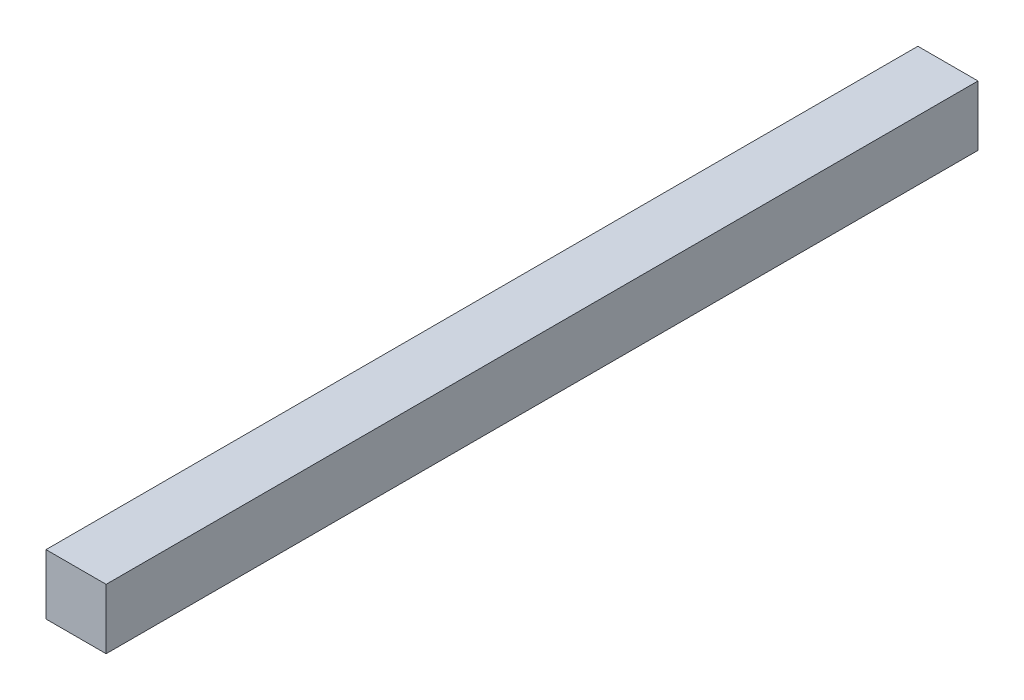
from build123d import *

# Parameters (mm, degrees)
SKETCH1_W           = 38.1
SKETCH1_H           = 38.1
BOSS_EXTRUDE1_DEPTH = 552.45


with BuildPart() as part:
    # Sketch1 → Boss-Extrude1 (new body)
    with BuildSketch(Plane.XY):
        with Locations((19.05, 19.05)):
            Rectangle(SKETCH1_W, SKETCH1_H)
    extrude(amount=BOSS_EXTRUDE1_DEPTH)


solid = part.part
